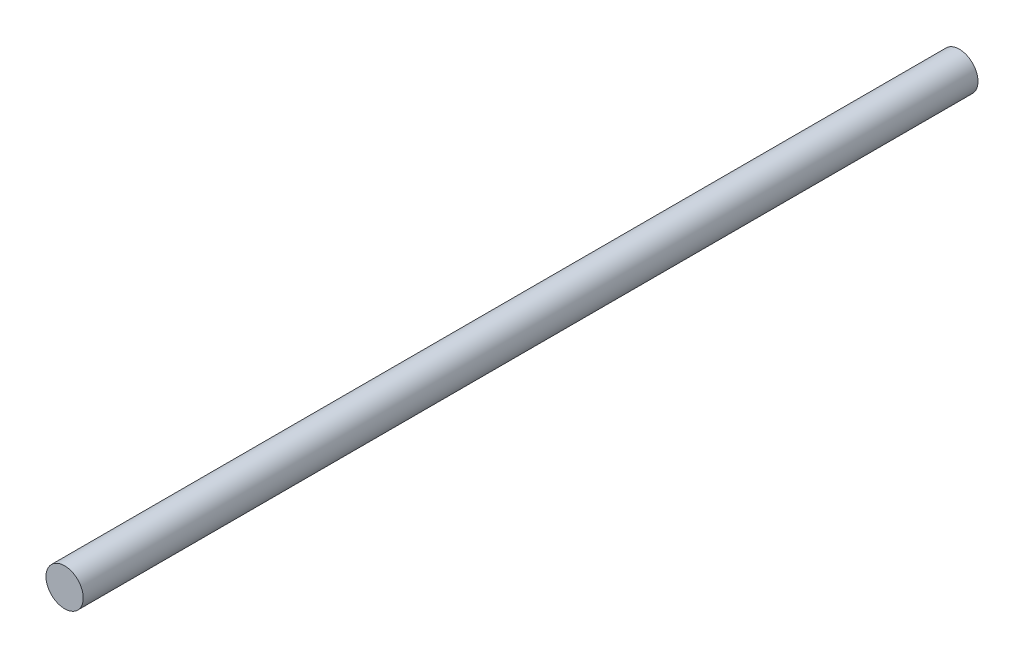
from build123d import *

# Parameters (mm, degrees)
BOSS_EXTRUDE1_DEPTH      = 30
BOSS_EXTRUDE1_DEPTH_BACK = 30
SKETCH1_R                = 1.25


with BuildPart() as part:
    # Sketch1 → Boss-Extrude1 (new, two sides: drawn at the far end of the back side and taken through both)
    with BuildSketch(Plane.XY.offset(-BOSS_EXTRUDE1_DEPTH_BACK)):
        Circle(SKETCH1_R)
    extrude(amount=BOSS_EXTRUDE1_DEPTH + BOSS_EXTRUDE1_DEPTH_BACK)


solid = part.part
